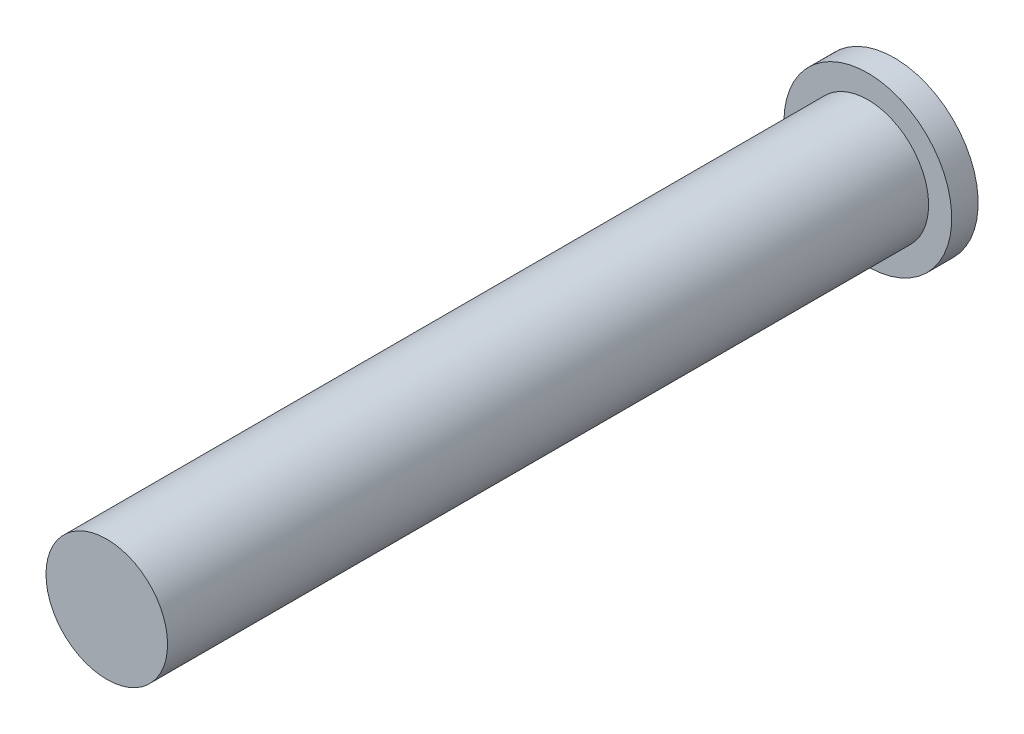
from build123d import *

# Parameters (mm, degrees)
CROQUIS1_R              = 11.5
SALIENTE_EXTRUIR1_DEPTH = 72
CROQUIS2_R              = 15.875
SALIENTE_EXTRUIR2_DEPTH = 5


with BuildPart() as part:
    # Croquis1 → Saliente-Extruir1 (new, symmetric)
    with BuildSketch(Plane.XY):
        Circle(CROQUIS1_R)
    extrude(amount=SALIENTE_EXTRUIR1_DEPTH, both=True)

    # Croquis2 → Saliente-Extruir2 (add)
    with BuildSketch(Plane(origin=(0, 0, -72), x_dir=(-1, 0, 0), z_dir=(0, 0, -1))):
        Circle(CROQUIS2_R)
    extrude(amount=SALIENTE_EXTRUIR2_DEPTH)


solid = part.part
